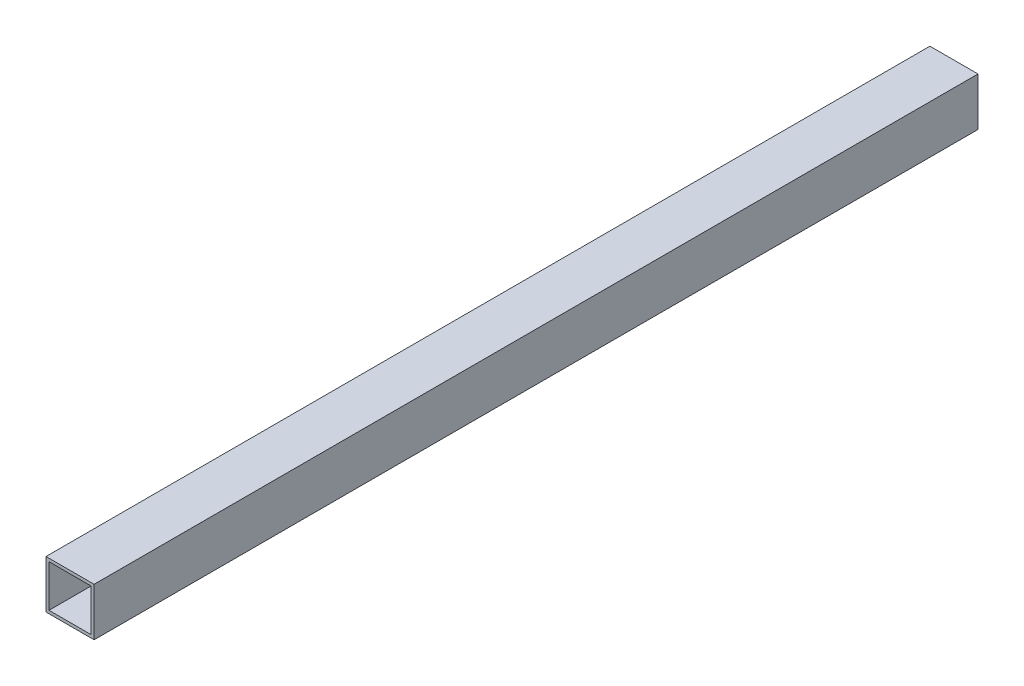
from build123d import *

# Parameters (mm, degrees)
CROQUIS1_W              = 76.2
CROQUIS1_H              = 76.2
CROQUIS1_W_2            = 66.675
CROQUIS1_H_2            = 66.675
SALIENTE_EXTRUIR1_DEPTH = 1400


with BuildPart() as part:
    # Croquis1 → Saliente-Extruir1 (new body)
    with BuildSketch(Plane.XY):
        with Locations((38.1, -38.1)):
            Rectangle(CROQUIS1_W, CROQUIS1_H)
        with Locations((38.1, -38.1)):
            Rectangle(CROQUIS1_W_2, CROQUIS1_H_2, mode=Mode.SUBTRACT)
    extrude(amount=SALIENTE_EXTRUIR1_DEPTH)


solid = part.part
